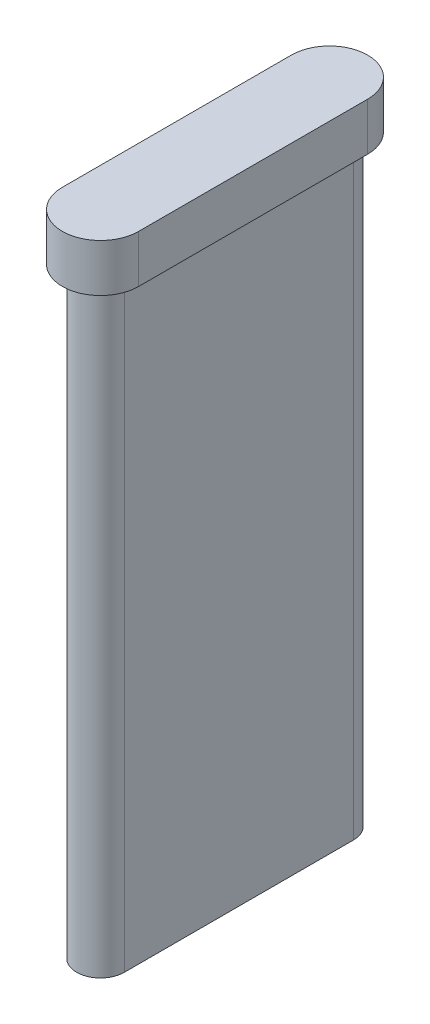
from build123d import *

# Parameters (mm, degrees)
BOSS_EXTRUDE1_DEPTH = 68
BOSS_EXTRUDE2_DEPTH = 5


with BuildPart() as part:
    # Sketch1 → Boss-Extrude1 (new body)
    with BuildSketch(Plane(origin=(0, 0, 0), x_dir=(1, 0, 0), z_dir=(0, 1, 0))):
        with BuildLine():
            Line((-2.5, -12), (-2.5, 12))
            ThreePointArc((-2.5, 12), (0, 14.5), (2.5, 12))
            Line((2.5, 12), (2.5, -12))
            ThreePointArc((2.5, -12), (0, -14.5), (-2.5, -12))
        make_face()
    extrude(amount=-BOSS_EXTRUDE1_DEPTH)

    # Sketch2 → Boss-Extrude2 (add)
    with BuildSketch(Plane(origin=(0, 0, 0), x_dir=(1, 0, 0), z_dir=(0, 1, 0))):
        with BuildLine():
            Line((4, -12), (4, 12))
            ThreePointArc((4, 12), (0, 16), (-4, 12))
            Line((-4, 12), (-4, -12))
            ThreePointArc((-4, -12), (0, -16), (4, -12))
        make_face()
    extrude(amount=-BOSS_EXTRUDE2_DEPTH)


solid = part.part
